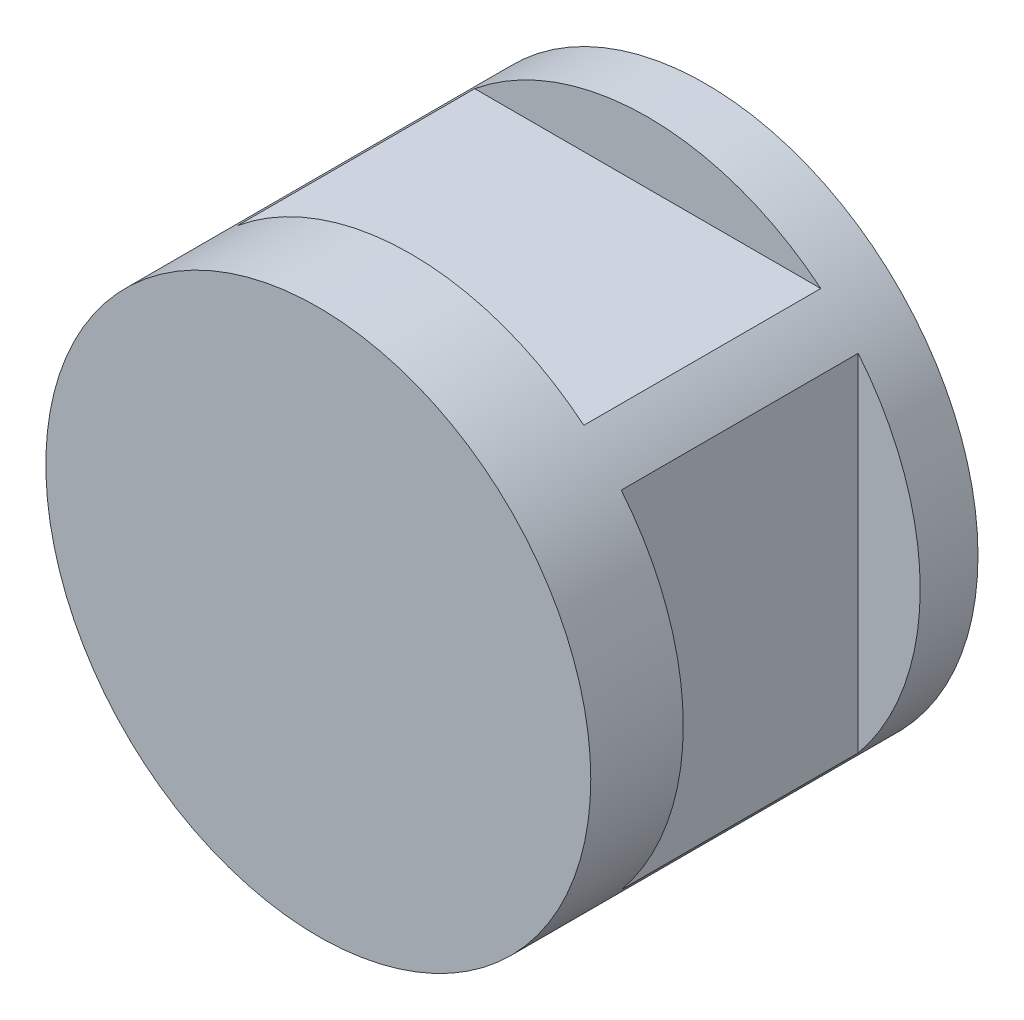
from build123d import *
from build123d.topology import SkipClean

# Parameters (mm, degrees)
SKETCH1_R           = 11.975000032
BOSS_EXTRUDE1_DEPTH = 4.064
BOSS_EXTRUDE2_DEPTH = 10.414
SKETCH3_R           = 11.975000032
BOSS_EXTRUDE3_DEPTH = 2.54


with BuildPart() as part:
    # Sketch1 → Boss-Extrude1 (new body)
    with BuildSketch(Plane.XY):
        Circle(SKETCH1_R)
    extrude(amount=-BOSS_EXTRUDE1_DEPTH)

    # Sketch2 → Boss-Extrude2 (add)
    with SkipClean():  # the faces are left unmerged after this step: merging them gives an invalid solid
        with BuildSketch(Plane(origin=(0, 0, -4.064), x_dir=(-1, 0, 0), z_dir=(0, 0, -1))):
            with BuildLine():
                ThreePointArc((9.250000032, 7.605138077), (8.467603727, 8.467603727), (7.605138077, 9.250000032))
                Line((7.605138077, 9.250000032), (-7.605138077, 9.250000032))
                ThreePointArc((-7.605138077, 9.250000032), (-8.467603727, 8.467603727), (-9.250000032, 7.605138077))
                Line((-9.250000032, 7.605138077), (-9.250000032, -7.605138077))
                ThreePointArc((-9.250000032, -7.605138077), (-8.467603727, -8.467603727), (-7.605138077, -9.250000032))
                Line((-7.605138077, -9.250000032), (7.605138077, -9.250000032))
                ThreePointArc((7.605138077, -9.250000032), (8.467603727, -8.467603727), (9.250000032, -7.605138077))
                Line((9.250000032, -7.605138077), (9.250000032, 7.605138077))
            make_face()
        extrude(amount=BOSS_EXTRUDE2_DEPTH)

    # Sketch3 → Boss-Extrude3 (add)
    with BuildSketch(Plane(origin=(0, 0, -14.478), x_dir=(-1, 0, 0), z_dir=(0, 0, -1))):
        Circle(SKETCH3_R)
    extrude(amount=BOSS_EXTRUDE3_DEPTH)


solid = part.part
